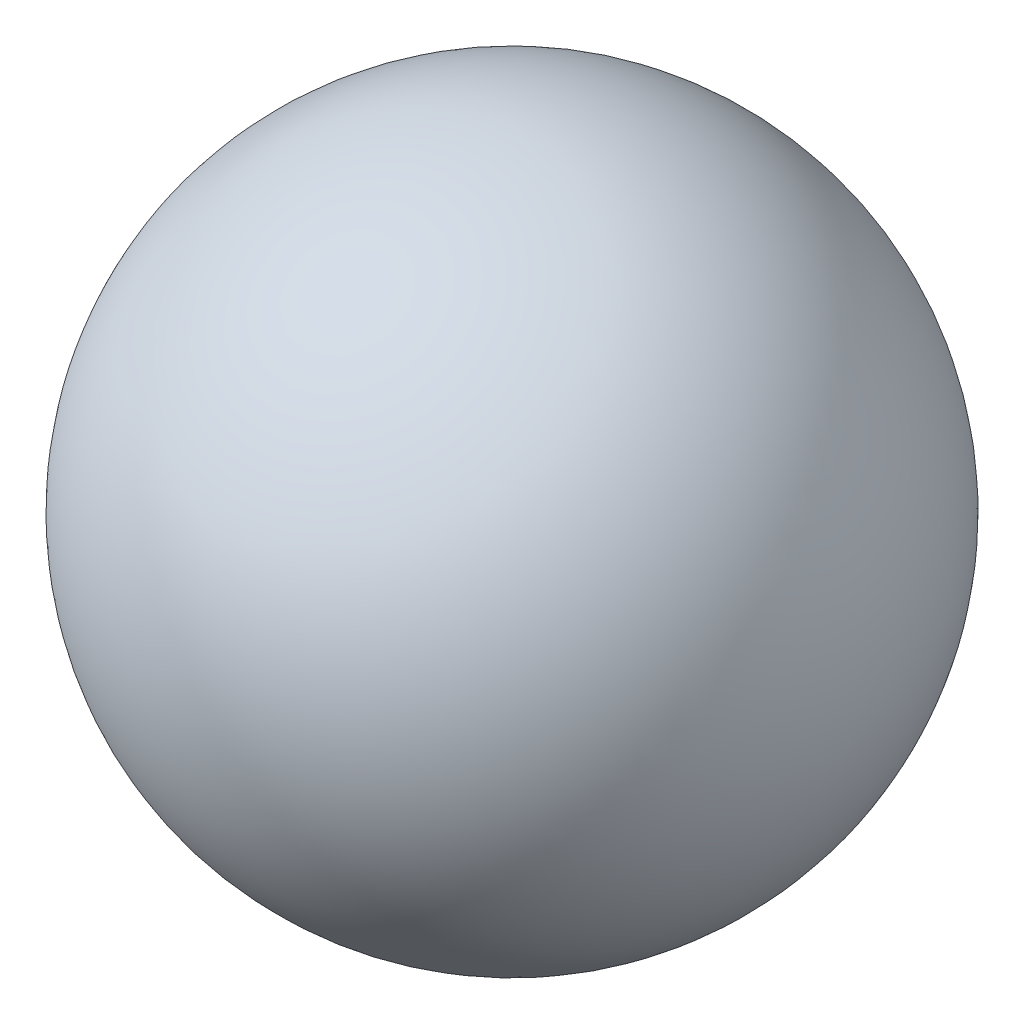
from build123d import *


with BuildPart() as part:
    # Sketch1 → Revolve2 (revolve)
    with BuildSketch(Plane(origin=(0, 0, 0), x_dir=(1, 0, 0), z_dir=(0, 1, 0))):
        with BuildLine():
            Line((-2.25, 0), (2.25, 0))
            ThreePointArc((2.25, 0), (0, -2.25), (-2.25, 0))
        make_face()
    revolve(axis=Axis((-2.25, 0, 0), (1, 0, 0)))


solid = part.part
